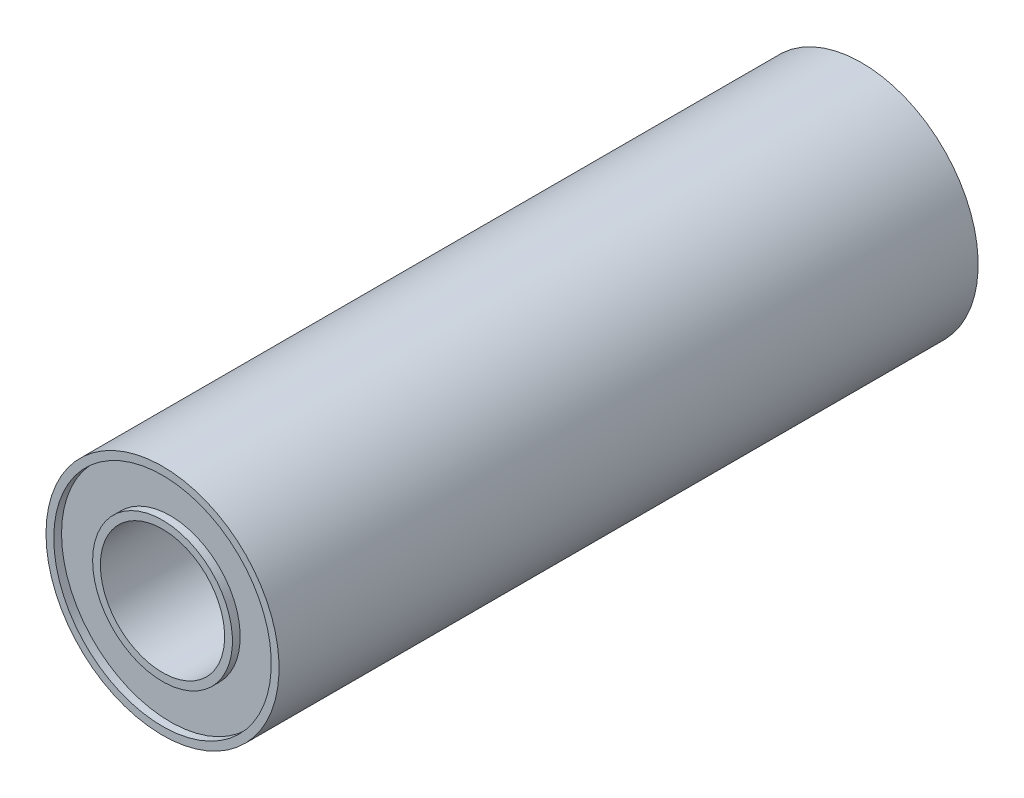
from build123d import *

# Parameters (mm, degrees)
SKETCH_1_R        = 7.5
SKETCH_1_R_2      = 7
EXTRUDE_2_DEPTH   = 22.5
SKETCH_1_R_3      = 4.5
SKETCH_1_R_4      = 4
EXTRUDE_2_2_DEPTH = 22.5
SKETCH_1_5_R      = 7
SKETCH_1_5_R_2    = 4.5
EXTRUDE_3_DEPTH   = 22


with BuildPart() as part:
    # 草图1 → 凸台-拉伸2 (new, symmetric)
    with BuildSketch(Plane.XY):
        Circle(SKETCH_1_R)
        Circle(SKETCH_1_R_2, mode=Mode.SUBTRACT)
    extrude(amount=EXTRUDE_2_DEPTH, both=True)



with BuildPart() as body_2:
    # 草图1 → Extrude 2 2 (new, symmetric)
    with BuildSketch(Plane.XY):
        Circle(SKETCH_1_R_3)
        Circle(SKETCH_1_R_4, mode=Mode.SUBTRACT)
    extrude(amount=EXTRUDE_2_2_DEPTH, both=True)


with BuildPart() as part_1:
    add(part.part)

    add(body_2.part)  # 凸台-拉伸3 merges body 2
    # 草图1<5> → 凸台-拉伸3 (add, symmetric)
    with BuildSketch(Plane.XY):
        Circle(SKETCH_1_5_R)
        Circle(SKETCH_1_5_R_2, mode=Mode.SUBTRACT)
    extrude(amount=EXTRUDE_3_DEPTH, both=True)


solid = part_1.part
